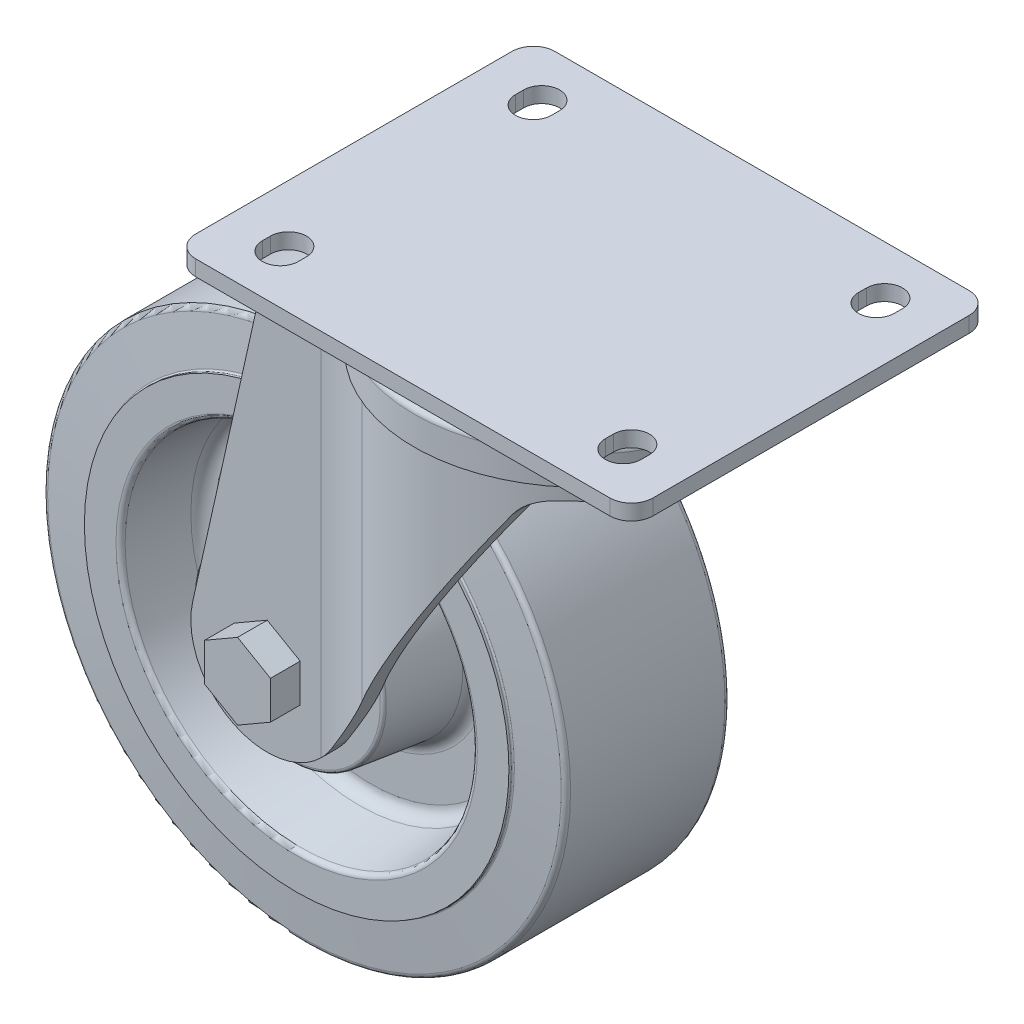
from build123d import *

# Parameters (mm, degrees)
BOSS_EXTRUDE1_DEPTH     = 119.805
CUT_EXTRUDE1_DEPTH      = 110
CUT_EXTRUDE1_DEPTH_BACK = 110
SKETCH2_W               = 215
SKETCH2_H               = 195
CUT_EXTRUDE2_DEPTH      = 195
BOSS_EXTRUDE2_DEPTH     = 4.7725
SKETCH6_W               = 63.05
SKETCH6_H               = 10.01
BOSS_EXTRUDE3_DEPTH     = 9.2
BOSS_EXTRUDE4_DEPTH     = 9.2


with BuildPart() as part:
    # Sketch1 → Boss-Extrude1 (new body)
    with BuildSketch(Plane(origin=(0, 95.036, 0), x_dir=(1, 0, 0), z_dir=(0, 1, 0))):
        with BuildLine():
            Line((-28.205, 36.5), (-28.205, -36.5))
            Line((-28.205, -36.5), (16.482762036, -36.5))
            ThreePointArc((16.482762036, -36.5), (25.593362937, -37.782545007), (33.995796826, -41.530487805))
            ThreePointArc((33.995796826, -41.530487805), (109, 0), (33.995796826, 41.530487805))
            ThreePointArc((33.995796826, 41.530487805), (25.593362937, 37.782545007), (16.482762036, 36.5))
            Line((16.482762036, 36.5), (-28.205, 36.5))
        make_face()
    extrude(amount=-BOSS_EXTRUDE1_DEPTH)

    # Sketch2 → Cut-Extrude1 (cut, two sides: drawn at the far end of the back side and taken through both)
    with BuildSketch(Plane.XY.offset(-CUT_EXTRUDE1_DEPTH_BACK)):
        with Locations((52.5, 32.5)):
            Rectangle(SKETCH2_W, SKETCH2_H)
        with BuildLine():
            Line((19.666732883, -12.679890287), (82.320130921, 84.496632186))
            ThreePointArc((82.320130921, 84.496632186), (86.300527875, 88.194337177), (91.565176294, 89.536))
            Line((91.565176294, 89.536), (100.76, 89.536))
            Line((100.76, 89.536), (100.76, 96.036))
            Line((100.76, 96.036), (-2.53, 96.036))
            Line((-2.53, 96.036), (-22.837474819, 5.099974892))
            ThreePointArc((-22.837474819, 5.099974892), (-9.030188401, -21.587396727), (19.666732883, -12.679890287))
        make_face(mode=Mode.SUBTRACT)
    extrude(amount=CUT_EXTRUDE1_DEPTH + CUT_EXTRUDE1_DEPTH_BACK, mode=Mode.SUBTRACT)

    # Sketch4 → Revolve1 (revolve)
    with BuildSketch(Plane.XY):
        with BuildLine():
            Line((60, 95.026), (8.48, 95.026))
            Line((8.48, 95.026), (8.48, 103.751))
            ThreePointArc((8.48, 103.751), (9.124365081, 105.306634919), (10.68, 105.951))
            Line((10.68, 105.951), (11.56, 105.951))
            ThreePointArc((11.56, 105.951), (9.382111114, 106.853111114), (8.48, 109.031))
            Line((8.48, 109.031), (8.48, 110.7235))
            Line((8.48, 110.7235), (60, 110.7235))
            Line((60, 110.7235), (60, 95.026))
        make_face()
    revolve(axis=Axis((60, 110.7235, 0), (0, -1, 0)))

    # Sketch3 → Cut-Extrude2 (cut)
    with BuildSketch(Plane(origin=(0, 89.536, 0), x_dir=(1, 0, 0), z_dir=(0, 1, 0))):
        with BuildLine():
            Line((-28.205, 31.5), (-28.205, -31.5))
            Line((-28.205, -31.5), (17.943490397, -31.5))
            ThreePointArc((17.943490397, -31.5), (27.345237955, -32.867625084), (35.967708798, -36.857142857))
            ThreePointArc((35.967708798, -36.857142857), (104, 0), (35.967708798, 36.857142857))
            ThreePointArc((35.967708798, 36.857142857), (27.345237955, 32.867625084), (17.943490397, 31.5))
            Line((17.943490397, 31.5), (-28.205, 31.5))
        make_face()
    extrude(amount=-CUT_EXTRUDE2_DEPTH, mode=Mode.SUBTRACT)

    # Sketch5 → Boss-Extrude2 (add)
    with BuildSketch(Plane(origin=(0, 115, 0), x_dir=(1, 0, 0), z_dir=(0, 1, 0))):
        with BuildLine():
            Line((-10, 48.4), (-10, -48.4))
            ThreePointArc((-10, -48.4), (-8.066904756, -53.066904756), (-3.4, -55))
            Line((-3.4, -55), (123.4, -55))
            ThreePointArc((123.4, -55), (128.066904756, -53.066904756), (130, -48.4))
            Line((130, -48.4), (130, 48.4))
            ThreePointArc((130, 48.4), (128.066904756, 53.066904756), (123.4, 55))
            Line((123.4, 55), (-3.4, 55))
            ThreePointArc((-3.4, 55), (-8.066904756, 53.066904756), (-10, 48.4))
        make_face()
        with BuildLine():
            Line((118, 37.5), (118, 40))
            ThreePointArc((118, 40), (112.5, 45.5), (107, 40))
            Line((107, 40), (107, 37.5))
            ThreePointArc((107, 37.5), (112.5, 32), (118, 37.5))
        make_face(mode=Mode.SUBTRACT)
        with BuildLine():
            Line((107, -37.5), (107, -40))
            ThreePointArc((107, -40), (112.5, -45.5), (118, -40))
            Line((118, -40), (118, -37.5))
            ThreePointArc((118, -37.5), (112.5, -32), (107, -37.5))
        make_face(mode=Mode.SUBTRACT)
        with BuildLine():
            Line((13, 37.5), (13, 40))
            ThreePointArc((13, 40), (7.5, 45.5), (2, 40))
            Line((2, 40), (2, 37.5))
            ThreePointArc((2, 37.5), (7.5, 32), (13, 37.5))
        make_face(mode=Mode.SUBTRACT)
        with BuildLine():
            Line((2, -37.5), (2, -40))
            ThreePointArc((2, -40), (7.5, -45.5), (13, -40))
            Line((13, -40), (13, -37.5))
            ThreePointArc((13, -37.5), (7.5, -32), (2, -37.5))
        make_face(mode=Mode.SUBTRACT)
    extrude(amount=-BOSS_EXTRUDE2_DEPTH)

    # Sketch6 → Revolve2 (revolve)
    with BuildSketch(Plane(origin=(0, 0, 0), x_dir=(0, 0, -1), z_dir=(1, 0, 0)), mode=Mode.PRIVATE) as revolve2_sk:
        with Locations((0, 5.005)):
            Rectangle(SKETCH6_W, SKETCH6_H)
    revolve(revolve2_sk.sketch.rotate(Axis((0, 0, -31.525), (0, 0, 1)), 90), axis=Axis((0, 0, -31.525), (0, 0, 1)))

    # Sketch7 → Boss-Extrude3 (add)
    with BuildSketch(Plane.XY.offset(45.6)):
        Polygon((-10.08, -5.819690713), (0, -11.639381427), (10.08, -5.819690713), (10.08, 5.819690713), (0, 11.639381427), (-10.08, 5.819690713), align=None)
    extrude(amount=-BOSS_EXTRUDE3_DEPTH)

    # Sketch8 → Boss-Extrude4 (add)
    with BuildSketch(Plane.XY.offset(-45.6)):
        Polygon((-10.08, -5.819690713), (0, -11.639381427), (10.08, -5.819690713), (10.08, 5.819690713), (0, 11.639381427), (-10.08, 5.819690713), align=None)
    extrude(amount=BOSS_EXTRUDE4_DEPTH)

    # Sketch9 → Revolve3 (revolve)
    with BuildSketch(Plane(origin=(0, 0, 0), x_dir=(0, 0, -1), z_dir=(1, 0, 0)), mode=Mode.PRIVATE) as revolve3_sk:
        with BuildLine():
            Line((-30, 28.115274735), (-30, 10))
            Line((-30, 10), (30, 10))
            Line((30, 10), (30, 28.115274735))
            ThreePointArc((30, 28.115274735), (29.748955721, 28.777894784), (29.121869343, 29.107820887))
            Line((29.121869343, 29.107820887), (8.262522626, 31.669026614))
            ThreePointArc((8.262522626, 31.669026614), (5.754177117, 32.988731028), (4.75, 35.639211221))
            Line((4.75, 35.639211221), (4.75, 47.667750181))
            ThreePointArc((4.75, 47.667750181), (5.754177117, 50.318230374), (8.262522626, 51.637934788))
            Line((8.262522626, 51.637934788), (26.182804015, 53.838268669))
            ThreePointArc((26.182804015, 53.838268669), (27.123433581, 54.333157825), (27.5, 55.327087897))
            Line((27.5, 55.327087897), (27.5, 65))
            Line((27.5, 65), (26.77049554, 65))
            ThreePointArc((26.77049554, 65), (26.432700436, 65.131361332), (26.272398191, 65.456422129))
            Line((26.272398191, 65.456422129), (25.119795286, 78.630733614))
            ThreePointArc((25.119795286, 78.630733614), (24.63888855, 79.605916005), (23.625503239, 80))
            Line((23.625503239, 80), (-23.625503239, 80))
            ThreePointArc((-23.625503239, 80), (-24.63888855, 79.605916005), (-25.119795286, 78.630733614))
            Line((-25.119795286, 78.630733614), (-26.272398191, 65.456422129))
            ThreePointArc((-26.272398191, 65.456422129), (-26.432700436, 65.131361332), (-26.77049554, 65))
            Line((-26.77049554, 65), (-27.5, 65))
            Line((-27.5, 65), (-27.5, 55.327087897))
            ThreePointArc((-27.5, 55.327087897), (-27.123433581, 54.333157825), (-26.182804015, 53.838268669))
            Line((-26.182804015, 53.838268669), (-8.262522626, 51.637934788))
            ThreePointArc((-8.262522626, 51.637934788), (-5.754177117, 50.318230374), (-4.75, 47.667750181))
            Line((-4.75, 47.667750181), (-4.75, 35.639211221))
            ThreePointArc((-4.75, 35.639211221), (-5.754177117, 32.988731028), (-8.262522626, 31.669026614))
            Line((-8.262522626, 31.669026614), (-29.121869343, 29.107820887))
            ThreePointArc((-29.121869343, 29.107820887), (-29.748955721, 28.777894784), (-30, 28.115274735))
        make_face()
    revolve(revolve3_sk.sketch.rotate(Axis((0, 0, -30), (0, 0, 1)), 90), axis=Axis((0, 0, -30), (0, 0, 1)))


solid = part.part
